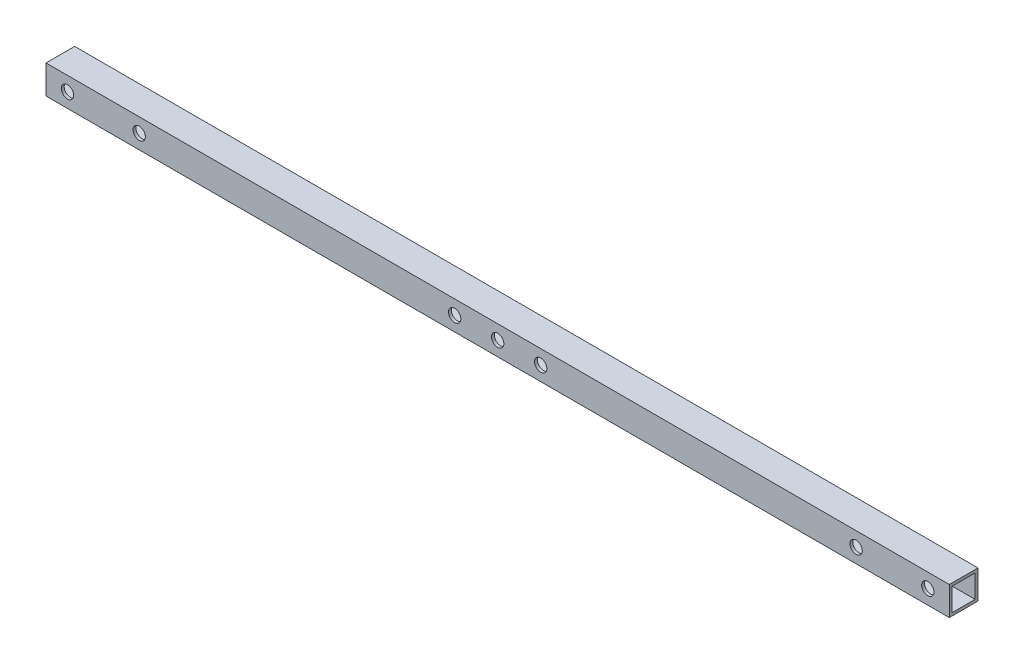
from build123d import *

# Parameters (mm, degrees)
SKETCH_1_W          = 10
SKETCH_1_H          = 10
SKETCH_1_W_2        = 8
SKETCH_1_H_2        = 8
EXTRUDE_1_DEPTH     = 315
SKETCH_2_R          = 2.15
CUT_EXTRUDE_1_DEPTH = 316.198350249


with BuildPart() as part:
    # ｽｹｯﾁ1 → 押し出し-薄板1 (new body)
    with BuildSketch(Plane(origin=(0, 0, 0), x_dir=(0, 0, -1), z_dir=(1, 0, 0))):
        Rectangle(SKETCH_1_W, SKETCH_1_H)
        Rectangle(SKETCH_1_W_2, SKETCH_1_H_2, mode=Mode.SUBTRACT)
    extrude(amount=EXTRUDE_1_DEPTH)

    # ｽｹｯﾁ2 → ｶｯﾄ - 押し出し1 (cut, through all)
    with BuildSketch(Plane.XY.offset(5)):
        with Locations((307.5, 0)):
            Circle(SKETCH_2_R)
        with Locations((282.5, 0)):
            Circle(SKETCH_2_R)
        with Locations(Location((7.5, 0, 0), (0, 0, 90))):
            Circle(SKETCH_2_R)
        with Locations(Location((32.5, 0, 0), (0, 0, 90))):
            Circle(SKETCH_2_R)
        with Locations((172.5, 0)):
            Circle(SKETCH_2_R)
        with Locations((157.5, 0)):
            Circle(SKETCH_2_R)
        with Locations(Location((142.5, 0, 0), (0, 0, 90))):
            Circle(SKETCH_2_R)
    extrude(amount=-CUT_EXTRUDE_1_DEPTH, mode=Mode.SUBTRACT)


solid = part.part
